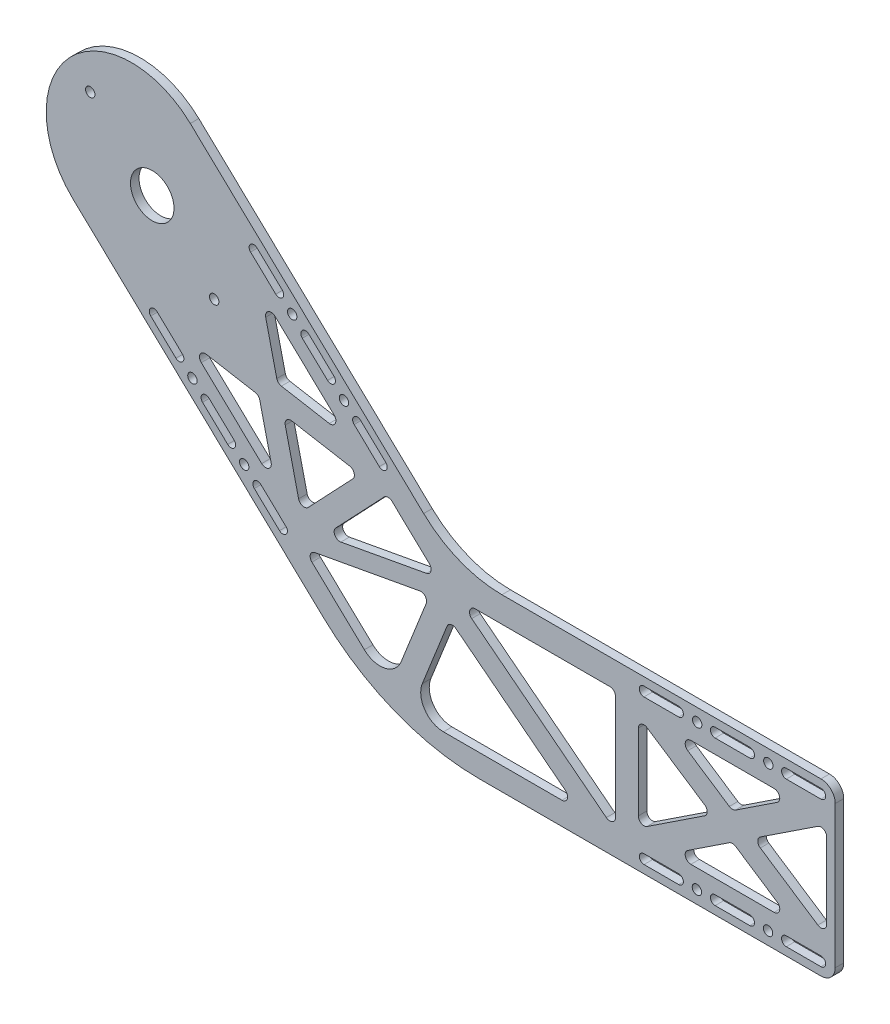
from build123d import *

# Parameters (mm, degrees)
SKETCH_1_R          = 7.65
EXTRUDE_1_DEPTH     = 3
SKETCH_2_R          = 5
CUT_EXTRUDE_1_DEPTH = 366.286189172
FILLET_1_R          = 20
SKETCH_3_R          = 1.65
CUT_EXTRUDE_2_DEPTH = 366.286189172
FILLET_2_R          = 40
FILLET_3_R          = 80
SKETCH_4_W          = 105
SKETCH_4_H          = 60
CUT_EXTRUDE_3_DEPTH = 366.286189172
FILLET_4_R          = 5
CUT_EXTRUDE_4_DEPTH = 269.344927286
FILLET_5_R          = 2
FILLET_6_R          = 8
EXTRUDE_START       = -3
EXTRUDE_2_DEPTH     = 3
SKETCH_7_R          = 1.65
CUT_EXTRUDE_5_DEPTH = 3


with BuildPart() as part:
    # 草图1 → 凸台-拉伸1 (new body)
    with BuildSketch(Plane.XY):
        with BuildLine():
            Line((106.954174428, -60), (20.632339437, 21.778580517))
            ThreePointArc((20.632339437, 21.778580517), (-21.778580517, 20.632339437), (-20.632339437, -21.778580517))
            Line((-20.632339437, -21.778580517), (83.045825572, -120))
            Line((83.045825572, -120), (345, -120))
            Line((345, -120), (345, -60))
            Line((345, -60), (106.954174428, -60))
        make_face()
        Circle(SKETCH_1_R, mode=Mode.SUBTRACT)
    extrude(amount=EXTRUDE_1_DEPTH)

    # 草图2 → 切除-拉伸1 (cut, through all)
    with BuildSketch(Plane.XY.offset(3)):
        with Locations((305, -90)):
            Circle(SKETCH_2_R)
        with Locations((278, -90)):
            Circle(SKETCH_2_R)
        with Locations((332, -90)):
            Circle(SKETCH_2_R)
    extrude(amount=-CUT_EXTRUDE_1_DEPTH, mode=Mode.SUBTRACT)

    # 圆角1
    fillet_1_edges = [part.edges().sort_by_distance(p)[0] for p in [
        (345, -60, 1.5),
        (345, -120, 1.5),
    ]]
    fillet(fillet_1_edges, radius=FILLET_1_R)

    # 草图3 → 切除-拉伸2 (cut, through all)
    with BuildSketch(Plane.XY.offset(3)):
        with Locations((216.4, -115.5)):
            Circle(SKETCH_3_R)
        with Locations((216.5, -64.5)):
            Circle(SKETCH_3_R)
        with Locations((191.5, -64.5)):
            Circle(SKETCH_3_R)
        with Locations((191.4, -115.5)):
            Circle(SKETCH_3_R)
        with Locations((14.114048497, -48.497460089)):
            Circle(SKETCH_3_R)
        with Locations((49.18902554, -11.473873209)):
            Circle(SKETCH_3_R)
        with Locations((67.385880926, -28.616640024)):
            Circle(SKETCH_3_R)
        with Locations((32.310903883, -65.640226903)):
            Circle(SKETCH_3_R)
        with BuildLine():
            Line((222.8, -113.85), (235, -113.85))
            ThreePointArc((235, -113.85), (236.65, -115.5), (235, -117.15))
            Line((235, -117.15), (222.8, -117.15))
            ThreePointArc((222.8, -117.15), (221.15, -115.5), (222.8, -113.85))
        make_face()
        with BuildLine():
            Line((222.8, -66.15), (235, -66.15))
            ThreePointArc((235, -66.15), (236.65, -64.5), (235, -62.85))
            Line((235, -62.85), (222.8, -62.85))
            ThreePointArc((222.8, -62.85), (221.15, -64.5), (222.8, -66.15))
        make_face()
        with BuildLine():
            Line((36.821084288, 2.51599917), (45.677707032, -5.874485534))
            ThreePointArc((45.677707032, -5.874485534), (45.740750291, -8.207086132), (43.408149694, -8.270129391))
            Line((43.408149694, -8.270129391), (34.55152695, 0.120355313))
            ThreePointArc((34.55152695, 0.120355313), (34.488483691, 2.452955911), (36.821084288, 2.51599917))
        make_face()
        with BuildLine():
            Line((19.942962631, -51.650354523), (28.799585375, -60.040839228))
            ThreePointArc((28.799585375, -60.040839228), (28.862628634, -62.373439825), (26.530028037, -62.436483085))
            Line((26.530028037, -62.436483085), (17.673405293, -54.04599838))
            ThreePointArc((17.673405293, -54.04599838), (17.610362034, -51.713397783), (19.942962631, -51.650354523))
        make_face()
        with BuildLine():
            Line((197.8, -113.85), (210, -113.85))
            ThreePointArc((210, -113.85), (211.65, -115.5), (210, -117.15))
            Line((210, -117.15), (197.8, -117.15))
            ThreePointArc((197.8, -117.15), (196.15, -115.5), (197.8, -113.85))
        make_face()
        with BuildLine():
            Line((197.8, -66.15), (210, -66.15))
            ThreePointArc((210, -66.15), (211.65, -64.5), (210, -62.85))
            Line((210, -62.85), (197.8, -62.85))
            ThreePointArc((197.8, -62.85), (196.15, -64.5), (197.8, -66.15))
        make_face()
        with BuildLine():
            Line((172.8, -113.85), (185, -113.85))
            ThreePointArc((185, -113.85), (186.65, -115.5), (185, -117.15))
            Line((185, -117.15), (172.8, -117.15))
            ThreePointArc((172.8, -117.15), (171.15, -115.5), (172.8, -113.85))
        make_face()
        with BuildLine():
            Line((172.8, -66.15), (185, -66.15))
            ThreePointArc((185, -66.15), (186.65, -64.5), (185, -62.85))
            Line((185, -62.85), (172.8, -62.85))
            ThreePointArc((172.8, -62.85), (171.15, -64.5), (172.8, -66.15))
        make_face()
        with BuildLine():
            Line((1.746107245, -34.507587709), (10.602729989, -42.898072413))
            ThreePointArc((10.602729989, -42.898072413), (10.665773248, -45.230673011), (8.333172651, -45.29371627))
            Line((8.333172651, -45.29371627), (-0.523450093, -36.903231566))
            ThreePointArc((-0.523450093, -36.903231566), (-0.586493353, -34.570630968), (1.746107245, -34.507587709))
        make_face()
        with BuildLine():
            Line((55.017939675, -14.626767644), (63.874562418, -23.017252349))
            ThreePointArc((63.874562418, -23.017252349), (63.937605678, -25.349852946), (61.60500508, -25.412896206))
            Line((61.60500508, -25.412896206), (52.748382337, -17.022411501))
            ThreePointArc((52.748382337, -17.022411501), (52.685339077, -14.689810904), (55.017939675, -14.626767644))
        make_face()
        with BuildLine():
            Line((38.139818017, -68.793121338), (46.996440761, -77.183606042))
            ThreePointArc((46.996440761, -77.183606042), (47.05948402, -79.51620664), (44.726883423, -79.579249899))
            Line((44.726883423, -79.579249899), (35.870260679, -71.188765195))
            ThreePointArc((35.870260679, -71.188765195), (35.80721742, -68.856164597), (38.139818017, -68.793121338))
        make_face()
        with BuildLine():
            Line((73.214795061, -31.769534459), (82.071417805, -40.160019163))
            ThreePointArc((82.071417805, -40.160019163), (82.134461064, -42.492619761), (79.801860466, -42.55566302))
            Line((79.801860466, -42.55566302), (70.945237723, -34.165178315))
            ThreePointArc((70.945237723, -34.165178315), (70.882194463, -31.832577718), (73.214795061, -31.769534459))
        make_face()
    extrude(amount=-CUT_EXTRUDE_2_DEPTH, mode=Mode.SUBTRACT)

    # 圆角2
    fillet_2_edges = [part.edges().sort_by_distance(p)[0] for p in [
        (106.954174428, -60, 1.5),
    ]]
    fillet(fillet_2_edges, radius=FILLET_2_R)

    # 圆角3
    fillet_3_edges = [part.edges().sort_by_distance(p)[0] for p in [
        (83.045825572, -120, 1.5),
    ]]
    fillet(fillet_3_edges, radius=FILLET_3_R)

    # 草图4 → 切除-拉伸3 (cut, through all)
    with BuildSketch(Plane.XY.offset(3)):
        with Locations((292.5, -90)):
            Rectangle(SKETCH_4_W, SKETCH_4_H)
    extrude(amount=-CUT_EXTRUDE_3_DEPTH, mode=Mode.SUBTRACT)

    # 圆角4
    fillet_4_edges = [part.edges().sort_by_distance(p)[0] for p in [
        (240, -120, 1.5),
        (240, -60, 1.5),
    ]]
    fillet(fillet_4_edges, radius=FILLET_4_R)

    # 草图5 → 切除-拉伸4 (cut, through all)
    with BuildSketch(Plane.XY.offset(3)):
        Polygon((170.8, -107.073879127), (170.8, -72.926120873), (196.643481613, -90), align=None)
        Polygon((107.673788457, -69), (162.8, -69), (162.8, -112), align=None)
        Polygon((182.624652559, -71.15), (203.9, -85.205873586), (225.175347441, -71.15), align=None)
        Polygon((211.156518387, -90), (237, -72.926120873), (237, -107.073879127), align=None)
        Polygon((182.624652559, -108.85), (203.9, -94.794126414), (225.175347441, -108.85), align=None)
        Polygon((104.589547434, -76.740160666), (149.792834925, -112), (90.539471777, -112), align=None)
        Polygon((83.107750181, -109.038663458), (97.619712786, -72.619680215), (53.254218477, -80.756370264), align=None)
        Polygon((60.248478543, -73.373540194), (82.827238337, -49.540404857), (100.242066861, -66.038663458), align=None)
        Polygon((12.415001138, -37.631100304), (37.481546744, -42.016378913), (43.304983555, -66.895294173), align=None)
        Polygon((38.334111759, -10.557272346), (44.066420967, -35.046871816), (68.740714664, -39.36352773), align=None)
        Polygon((46.048599826, -43.515146043), (73.041613266, -48.237451473), (52.282913666, -70.149412161), align=None)
    extrude(amount=-CUT_EXTRUDE_4_DEPTH, mode=Mode.SUBTRACT)

    # 圆角5
    fillet_5_edges = [part.edges().sort_by_distance(p)[0] for p in [
        (53.254218477, -80.756370264, 1.5),
        (97.619712786, -72.619680215, 1.5),
        (104.589547434, -76.740160666, 1.5),
        (149.792834925, -112, 1.5),
        (100.242066861, -66.038663458, 1.5),
        (60.248478543, -73.373540194, 1.5),
        (82.827238337, -49.540404857, 1.5),
        (43.304983555, -66.895294173, 1.5),
        (12.415001138, -37.631100304, 1.5),
        (37.481546744, -42.016378913, 1.5),
        (237, -107.073879127, 1.5),
        (211.156518387, -90, 1.5),
        (237, -72.926120873, 1.5),
        (182.624652559, -71.15, 1.5),
        (225.175347441, -71.15, 1.5),
        (203.9, -85.205873586, 1.5),
        (225.175347441, -108.85, 1.5),
        (182.624652559, -108.85, 1.5),
        (203.9, -94.794126414, 1.5),
        (162.8, -112, 1.5),
        (107.673788457, -69, 1.5),
        (162.8, -69, 1.5),
        (38.334111759, -10.557272346, 1.5),
        (68.740714664, -39.36352773, 1.5),
        (44.066420967, -35.046871816, 1.5),
        (52.282913666, -70.149412161, 1.5),
        (46.048599826, -43.515146043, 1.5),
        (73.041613266, -48.237451473, 1.5),
        (196.643481613, -90, 1.5),
        (170.8, -107.073879127, 1.5),
        (170.8, -72.926120873, 1.5),
    ]]
    fillet(fillet_5_edges, radius=FILLET_5_R)

    # 圆角6
    fillet_6_edges = [part.edges().sort_by_distance(p)[0] for p in [
        (83.107750181, -109.038663458, 1.5),
        (90.539471777, -112, 1.5),
    ]]
    fillet(fillet_6_edges, radius=FILLET_6_R)

    # 草图6 → 凸台-拉伸2 (add)
    with BuildSketch(Plane.XY.offset(3).offset(EXTRUDE_START)):
        with BuildLine():
            Line((-27.891866276, -14.901134038), (-20.632339437, -21.778580517))
            ThreePointArc((-20.632339437, -21.778580517), (-21.778580517, 20.632339437), (20.632339437, 21.778580517))
            Line((20.632339437, 21.778580517), (13.372812598, 28.656026996))
            ThreePointArc((13.372812598, 28.656026996), (-29.038107356, 27.509785916), (-27.891866276, -14.901134038))
        make_face()
    extrude(amount=EXTRUDE_2_DEPTH)

    # 草图7 → 切除-拉伸5 (cut)
    with BuildSketch(Plane.XY.offset(3)):
        with Locations((-21.778580517, 20.632339437)):
            Circle(SKETCH_7_R)
        with Locations((21.778580517, -20.632339437)):
            Circle(SKETCH_7_R)
    extrude(amount=-CUT_EXTRUDE_5_DEPTH, mode=Mode.SUBTRACT)


solid = part.part
